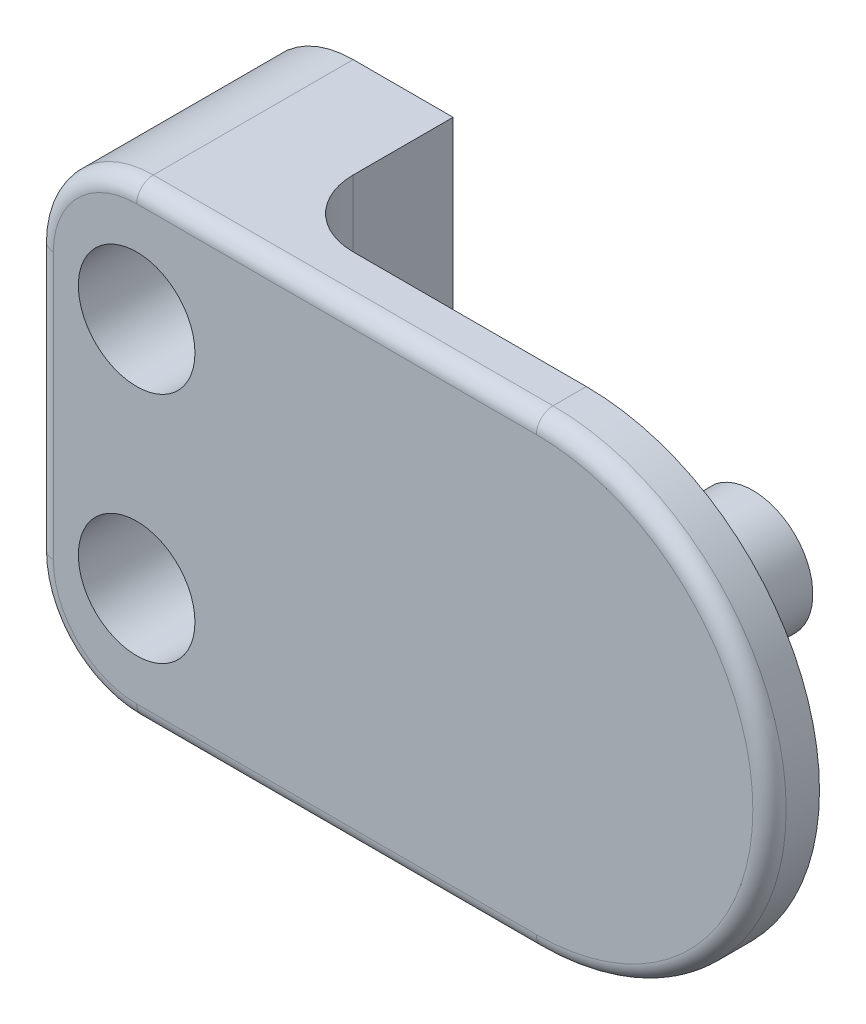
from build123d import *
from build123d.topology import SkipClean

# Parameters (mm, degrees)
SKETCH1_R           = 1.1
BOSS_EXTRUDE1_DEPTH = 1.5
SKETCH2_R           = 2.5
BOSS_EXTRUDE2_DEPTH = 1
BOSS_EXTRUDE3_DEPTH = 4
BOSS_EXTRUDE4_START = 5
SKETCH4_W           = 6
SKETCH4_H           = 14
SKETCH4_R           = 1.1
BOSS_EXTRUDE4_DEPTH = 5
FILLET4_R           = 3
FILLET1_R           = 0.5
SKETCH5_R           = 1.75
CUT_EXTRUDE1_DEPTH  = 4
FILLET3_R           = 2


with BuildPart() as part:
    # Sketch1 → Boss-Extrude1 (new body)
    with BuildSketch(Plane.XY):
        with BuildLine():
            Line((-15, 7), (0, 7))
            ThreePointArc((0, 7), (7, 0), (0, -7))
            Line((0, -7), (-15, -7))
            Line((-15, -7), (-15, 7))
        make_face()
        with Locations((-12, 3.5)):
            Circle(SKETCH1_R, mode=Mode.SUBTRACT)
        with Locations(Location((-12, -3.5, 0), (0, 0, 180))):
            Circle(SKETCH1_R, mode=Mode.SUBTRACT)
    extrude(amount=BOSS_EXTRUDE1_DEPTH)

    # Sketch2 → Boss-Extrude2 (add)
    with BuildSketch(Plane(origin=(0, 0, 0), x_dir=(-1, 0, 0), z_dir=(0, 0, -1))):
        Circle(SKETCH2_R)
    extrude(amount=BOSS_EXTRUDE2_DEPTH)

    # Sketch3 → Boss-Extrude3 (add)
    with BuildSketch(Plane(origin=(0, 0, -1), x_dir=(-1, 0, 0), z_dir=(0, 0, -1))):
        with BuildLine():
            Line((1.13862177, 1.394109201), (1.13862177, -1.394109201))
            ThreePointArc((1.13862177, -1.394109201), (-1.8, 0), (1.13862177, 1.394109201))
        make_face()
    extrude(amount=BOSS_EXTRUDE3_DEPTH)

    # Sketch4 → Boss-Extrude4 (add)
    with SkipClean():  # the faces are left unmerged after this step: merging them gives an invalid solid
        with BuildSketch(Plane(origin=(0, 0, 0), x_dir=(-1, 0, 0), z_dir=(0, 0, -1)).offset(BOSS_EXTRUDE4_START)):
            with Locations((12, 0)):
                Rectangle(SKETCH4_W, SKETCH4_H)
            with Locations((12, 3.5)):
                Circle(SKETCH4_R, mode=Mode.SUBTRACT)
            with Locations((12, -3.5)):
                Circle(SKETCH4_R, mode=Mode.SUBTRACT)
        extrude(amount=-BOSS_EXTRUDE4_DEPTH)

    # Fillet4
    fillet4_edges = [part.edges().sort_by_distance(p)[0] for p in [
        (-15, -7, -2.5),
        (-15, 7, -2.5),
    ]]
    fillet(fillet4_edges, radius=FILLET4_R)

    # Fillet1
    fillet1_edges = [part.edges().sort_by_distance(p)[0] for p in [
        (7, 0, 1.5),
        (-15, 0, 1.5),
        (-6, -7, 1.5),
        (-14.121320344, -6.121320344, 1.5),
        (-14.121320344, 6.121320344, 1.5),
        (-6, 7, 1.5),
    ]]
    fillet(fillet1_edges, radius=FILLET1_R)

    # Sketch5 → Cut-Extrude1 (cut)
    with BuildSketch(Plane.XY.offset(1.5)):
        with Locations((-12, 3.5)):
            Circle(SKETCH5_R)
        with Locations((-12, -3.5)):
            Circle(SKETCH5_R)
    extrude(amount=-CUT_EXTRUDE1_DEPTH, mode=Mode.SUBTRACT)

    # Fillet3
    fillet3_edges = [part.edges().sort_by_distance(p)[0] for p in [
        (-9, 0, 0),
    ]]
    fillet(fillet3_edges, radius=FILLET3_R)


solid = part.part
